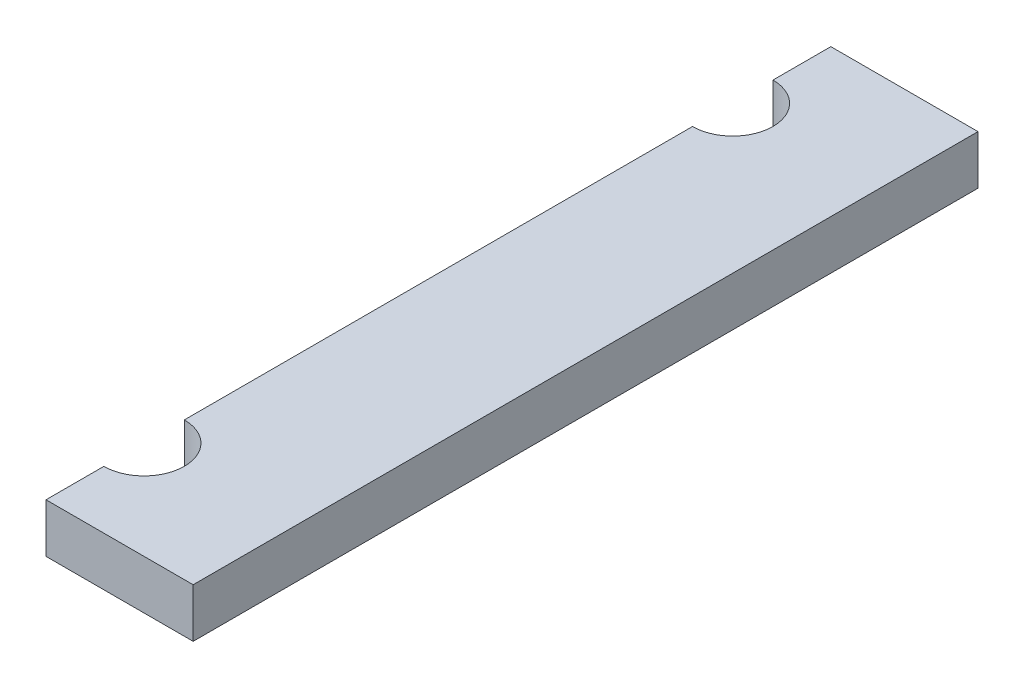
from build123d import *

# Parameters (mm, degrees)
BOSS_EXTRUDE1_DEPTH = 5


with BuildPart() as part:
    # Sketch1 → Boss-Extrude1 (new body)
    with BuildSketch(Plane(origin=(0, 0, 0), x_dir=(1, 0, 0), z_dir=(0, 1, 0))):
        with BuildLine():
            Line((15, 40), (0, 40))
            Line((0, 40), (0, 14.1))
            ThreePointArc((0, 14.1), (2.899137803, 12.899137803), (4.1, 10))
            ThreePointArc((4.1, 10), (2.899137803, 7.100862197), (0, 5.9))
            Line((0, 5.9), (0, 0))
            Line((0, 0), (15, 0))
            Line((15, 0), (15, 40))
        make_face()
        with BuildLine():
            Line((0, 65.9), (0, 40))
            Line((0, 40), (15, 40))
            Line((15, 40), (15, 80))
            Line((15, 80), (0, 80))
            Line((0, 80), (0, 74.1))
            ThreePointArc((0, 74.1), (2.899137803, 72.899137803), (4.1, 70))
            ThreePointArc((4.1, 70), (2.899137803, 67.100862197), (0, 65.9))
        make_face()
    extrude(amount=BOSS_EXTRUDE1_DEPTH)


solid = part.part
